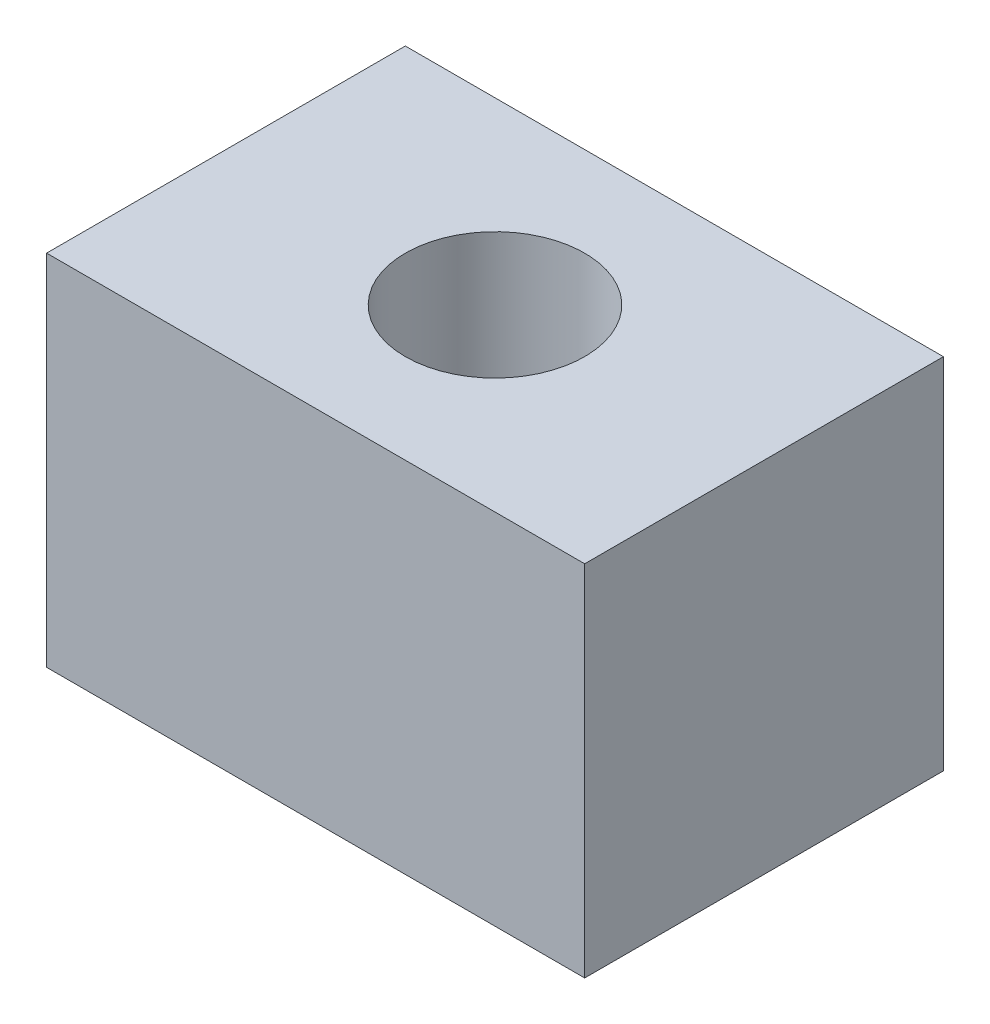
from build123d import *

# Parameters (mm, degrees)
ESQUISSE1_W        = 9
ESQUISSE1_H        = 6
ESQUISSE1_R        = 1.5
BOSS_EXTRU_1_DEPTH = 6


with BuildPart() as part:
    # Esquisse1 → Boss.-Extru.1 (new body)
    with BuildSketch(Plane(origin=(0, 0, 0), x_dir=(1, 0, 0), z_dir=(0, 1, 0))):
        Rectangle(ESQUISSE1_W, ESQUISSE1_H)
        with Locations(Location((0, 0, 0), (0, 0, 270))):
            Circle(ESQUISSE1_R, mode=Mode.SUBTRACT)
    extrude(amount=BOSS_EXTRU_1_DEPTH)


solid = part.part
